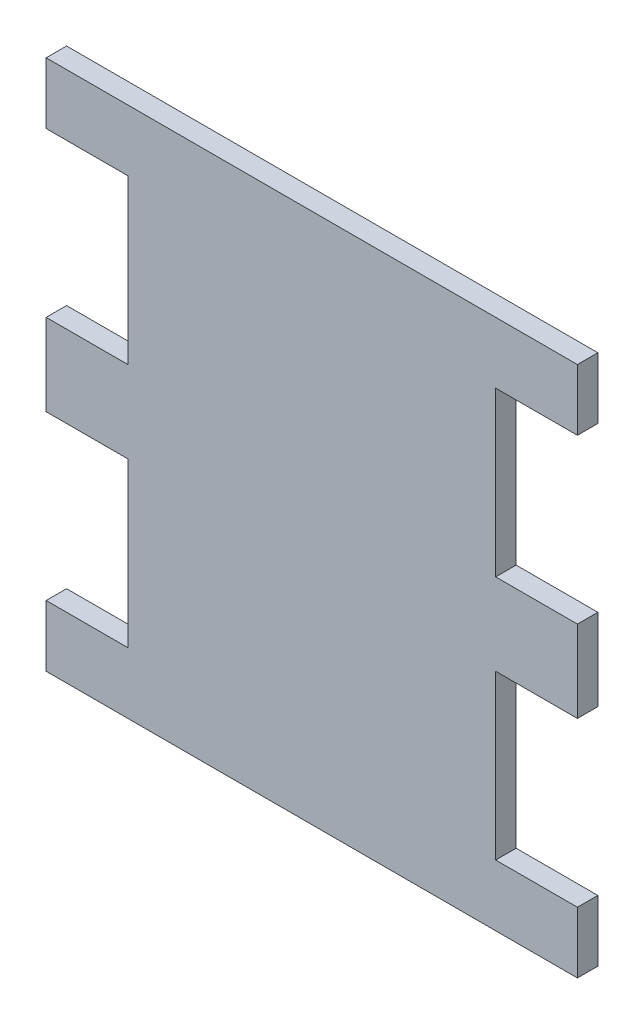
from build123d import *

# Parameters (mm, degrees)
ESQUISSE1_W             = 130
ESQUISSE1_H             = 130
BOSS_EXTRU_1_DEPTH      = 5
ESQUISSE2_W             = 20
ESQUISSE2_H             = 40
ENL_V_MAT_EXTRU_1_DEPTH = 10
ESQUISSE3_W             = 20
ESQUISSE3_H             = 40
ENL_V_MAT_EXTRU_2_DEPTH = 10


with BuildPart() as part:
    # Esquisse1 → Boss.-Extru.1 (new body)
    with BuildSketch(Plane.XY):
        with Locations((31.574099396, -23.428129952)):
            Rectangle(ESQUISSE1_W, ESQUISSE1_H)
    extrude(amount=BOSS_EXTRU_1_DEPTH)

    # Esquisse2 → Enlèv. mat.-Extru.1 (cut)
    with BuildSketch(Plane.XY.offset(5)):
        with Locations((-23.425900604, 6.571870048)):
            Rectangle(ESQUISSE2_W, ESQUISSE2_H)
        with Locations((-23.425900604, -53.428129952)):
            Rectangle(ESQUISSE2_W, ESQUISSE2_H)
    extrude(amount=-ENL_V_MAT_EXTRU_1_DEPTH, mode=Mode.SUBTRACT)

    # Esquisse3 → Enlèv. mat.-Extru.2 (cut)
    with BuildSketch(Plane.XY.offset(5)):
        with Locations((86.574099396, 6.571870048)):
            Rectangle(ESQUISSE3_W, ESQUISSE3_H)
        with Locations((86.574099396, -53.428129952)):
            Rectangle(ESQUISSE3_W, ESQUISSE3_H)
    extrude(amount=-ENL_V_MAT_EXTRU_2_DEPTH, mode=Mode.SUBTRACT)


solid = part.part
